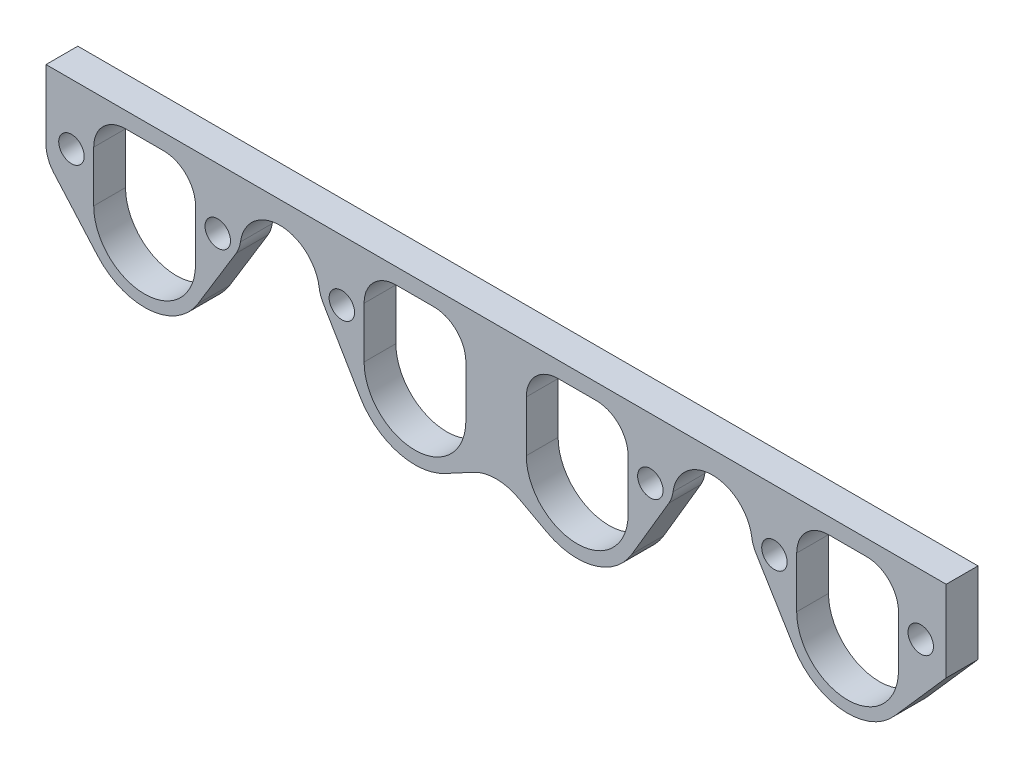
from build123d import *

# Parameters (mm, degrees)
CROQUIS2_W              = 283
CROQUIS2_H              = 51
SALIENTE_EXTRUIR1_DEPTH = 10
CROQUIS3_R              = 4
CORTAR_EXTRUIR1_DEPTH   = 20
REDONDEO1_R             = 10
REDONDEO2_R             = 10
CORTAR_EXTRUIR4_DEPTH   = 10
REDONDEO3_R             = 15
REDONDEO4_R             = 10


with BuildPart() as part:
    # Croquis2 → Saliente-Extruir1 (new body)
    with BuildSketch(Plane.XY):
        with Locations((141.5, -25.5)):
            Rectangle(CROQUIS2_W, CROQUIS2_H)
    extrude(amount=SALIENTE_EXTRUIR1_DEPTH)

    # Croquis3 → Cortar-Extruir1 (cut)
    with BuildSketch(Plane.XY.offset(10)):
        with Locations((8, -19)):
            Circle(CROQUIS3_R)
        with Locations((54, -19)):
            Circle(CROQUIS3_R)
        with Locations((93, -19)):
            Circle(CROQUIS3_R)
        with Locations((190, -19)):
            Circle(CROQUIS3_R)
        with Locations((229, -19)):
            Circle(CROQUIS3_R)
        with Locations((275, -19)):
            Circle(CROQUIS3_R)
        with BuildLine():
            Line((15, -31), (15, -5))
            Line((15, -5), (47, -5))
            Line((47, -5), (47, -31))
            ThreePointArc((47, -31), (31, -47), (15, -31))
        make_face()
        with BuildLine():
            Line((47.780695143, -41.215325703), (61, -19.5))
            ThreePointArc((61, -19.5), (73.5, -7), (86, -19.5))
            Line((86, -19.5), (98.77233825, -41.15911761))
            ThreePointArc((98.77233825, -41.15911761), (110.619100223, -50.262552209), (125.468650325, -48.616601858))
            Line((125.468650325, -48.616601858), (139.852321867, -40.885601446))
            Line((139.852321867, -40.885601446), (137.350385148, -76.220312807))
            Line((137.350385148, -76.220312807), (73.184426508, -72.914596395))
            Line((73.184426508, -72.914596395), (-5.481789583, -72.914596395))
            Line((-5.481789583, -72.914596395), (-5.481789583, -47.917494117))
            Line((-5.481789583, -47.917494117), (0, -25.5))
            Line((0, -25.5), (16.248287874, -43.974266764))
            ThreePointArc((16.248287874, -43.974266764), (32.712346917, -50.570704554), (47.780695143, -41.215325703))
        make_face()
        with BuildLine():
            Line((100, -31), (100, -5))
            Line((100, -5), (132, -5))
            Line((132, -5), (132, -31))
            ThreePointArc((132, -31), (116, -47), (100, -31))
        make_face()
        with BuildLine():
            Line((143.147678133, -40.885601446), (145.649614852, -76.220312807))
            Line((145.649614852, -76.220312807), (209.815573492, -72.914596395))
            Line((209.815573492, -72.914596395), (288.481789583, -72.914596395))
            Line((288.481789583, -72.914596395), (288.481789583, -47.917494117))
            Line((288.481789583, -47.917494117), (283, -25.5))
            Line((283, -25.5), (266.751712126, -43.974266764))
            ThreePointArc((266.751712126, -43.974266764), (250.287653083, -50.570704554), (235.219304857, -41.215325703))
            Line((235.219304857, -41.215325703), (222, -19.5))
            ThreePointArc((222, -19.5), (209.5, -7), (197, -19.5))
            Line((197, -19.5), (184.22766175, -41.15911761))
            ThreePointArc((184.22766175, -41.15911761), (172.380899777, -50.262552209), (157.531349675, -48.616601858))
            Line((157.531349675, -48.616601858), (143.147678133, -40.885601446))
        make_face()
        with BuildLine():
            Line((151, -5), (151, -31))
            ThreePointArc((151, -31), (167, -47), (183, -31))
            Line((183, -31), (183, -5))
            Line((183, -5), (151, -5))
        make_face()
        with BuildLine():
            Line((236, -5), (236, -31))
            ThreePointArc((236, -31), (252, -47), (268, -31))
            Line((268, -31), (268, -5))
            Line((268, -5), (236, -5))
        make_face()
    extrude(amount=-CORTAR_EXTRUIR1_DEPTH, mode=Mode.SUBTRACT)

    # Redondeo1
    redondeo1_edges = [part.edges().sort_by_distance(p)[0] for p in [
        (61, -19.5, 5),
    ]]
    fillet(redondeo1_edges, radius=REDONDEO1_R)

    # Redondeo2
    redondeo2_edges = [part.edges().sort_by_distance(p)[0] for p in [
        (0, -25.5, 5),
        (86, -19.5, 5),
        (47, -5, 5),
        (15, -5, 5),
        (132, -5, 5),
        (100, -5, 5),
    ]]
    fillet(redondeo2_edges, radius=REDONDEO2_R)

    # Croquis6 → Cortar-Extruir4 (cut)
    with BuildSketch(Plane.XY.offset(10)):
        Polygon((143.147678133, -40.885601446), (141.5, -40), (139.852321867, -40.885601446), (139.136153993, -51), (143.863846007, -51), align=None)
    extrude(amount=-CORTAR_EXTRUIR4_DEPTH, mode=Mode.SUBTRACT)

    # Redondeo3
    redondeo3_edges = [part.edges().sort_by_distance(p)[0] for p in [
        (141.5, -40, 5),
    ]]
    fillet(redondeo3_edges, radius=REDONDEO3_R)

    # Redondeo4
    redondeo4_edges = [part.edges().sort_by_distance(p)[0] for p in [
        (236, -5, 5),
        (268, -5, 5),
        (197, -19.5, 5),
        (222, -19.5, 5),
        (151, -5, 5),
        (183, -5, 5),
    ]]
    fillet(redondeo4_edges, radius=REDONDEO4_R)


solid = part.part
